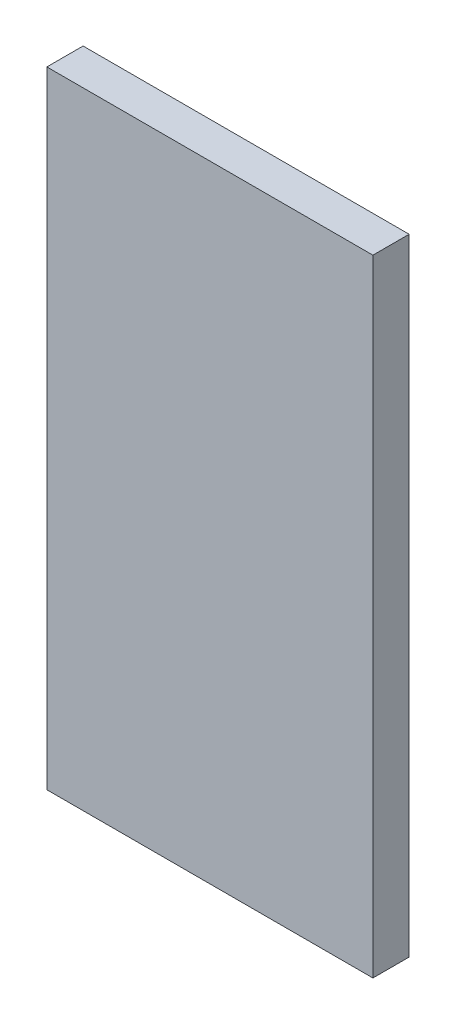
from build123d import *

# Parameters (mm, degrees)
SKETCH1_W           = 57.15
SKETCH1_H           = 71.628
BOSS_EXTRUDE1_DEPTH = 6.35
SKETCH2_W           = 57.15
SKETCH2_H           = 6.35
BOSS_EXTRUDE2_DEPTH = 38.1


with BuildPart() as part:
    # Sketch1 → Boss-Extrude1 (new body)
    with BuildSketch(Plane.XY):
        with Locations((8.55444936, -11.037464326)):
            Rectangle(SKETCH1_W, SKETCH1_H)
    extrude(amount=BOSS_EXTRUDE1_DEPTH)

    # Sketch2 → Boss-Extrude2 (add)
    with BuildSketch(Plane(origin=(0, 24.776535674, 0), x_dir=(1, 0, 0), z_dir=(0, 1, 0))):
        with Locations((8.55444936, -3.175)):
            Rectangle(SKETCH2_W, SKETCH2_H)
    extrude(amount=BOSS_EXTRUDE2_DEPTH)


solid = part.part
